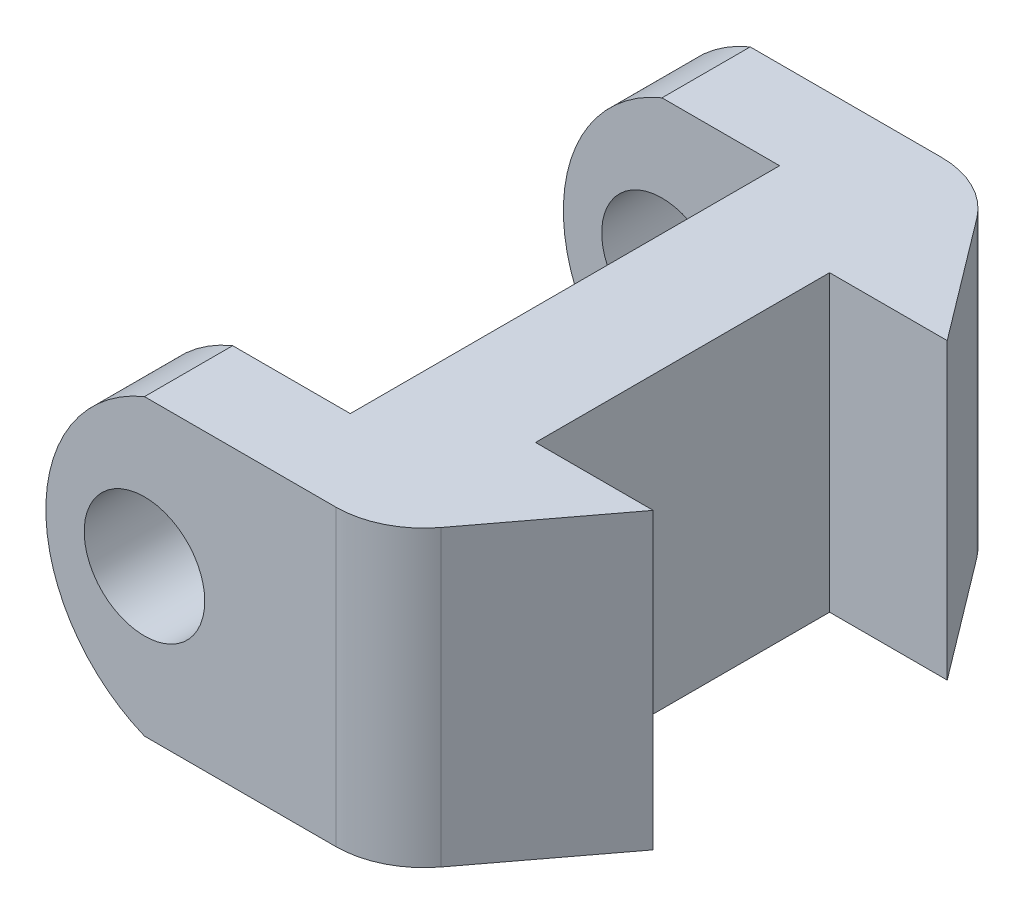
from build123d import *

# Parameters (mm, degrees)
BOSS_EXTRUDE1_DEPTH     = 10
CUT_EXTRUDE1_DEPTH      = 22.113029153
CUT_EXTRUDE1_DEPTH_BACK = 22.113029153
BOSS_EXTRUDE2_DEPTH     = 10
FILLET1_R               = 3
CUT_EXTRUDE2_DEPTH      = 25.987196722
CUT_EXTRUDE2_DEPTH_BACK = 25.987196722


with BuildPart() as part:
    # Sketch1 → Boss-Extrude1 (new body)
    with BuildSketch(Plane(origin=(0, 0, 0), x_dir=(1, 0, 0), z_dir=(0, 1, 0))):
        Polygon((-6, -10.3), (6, -10.3), (6, 10.3), (-6, 10.3), (-6, 7.3), (2, 7.3), (2, -7.3), (-6, -7.3), align=None)
    extrude(amount=BOSS_EXTRUDE1_DEPTH)

    # Sketch2 → Cut-Extrude1 (cut, two sides: drawn at the far end of the back side and taken through both)
    with BuildSketch(Plane.XY.offset(-7.3).offset(-CUT_EXTRUDE1_DEPTH_BACK)):
        with BuildLine():
            ThreePointArc((-3.280624847, 6.600781059), (-3.600781059, 3.719375153), (-0.719375153, 3.399218941))
            Line((-0.719375153, 3.399218941), (-3.280624847, 6.600781059))
        make_face()
        with BuildLine():
            Line((-3.280624847, 6.600781059), (-0.719375153, 3.399218941))
            ThreePointArc((-0.719375153, 3.399218941), (-0.152328366, 4.111963102), (0.05, 5))
            ThreePointArc((0.05, 5), (-1.111963102, 6.847671634), (-3.280624847, 6.600781059))
        make_face()
    extrude(amount=CUT_EXTRUDE1_DEPTH + CUT_EXTRUDE1_DEPTH_BACK, mode=Mode.SUBTRACT)

    # Sketch3 → Boss-Extrude2 (add)
    with BuildSketch(Plane(origin=(0, 10, 0), x_dir=(1, 0, 0), z_dir=(0, 1, 0))):
        Polygon((10, 5), (6, 10.3), (6, 5), align=None)
        Polygon((6, -10.3), (10, -5), (6, -5), align=None)
    extrude(amount=-BOSS_EXTRUDE2_DEPTH)

    # Fillet1
    fillet1_edges = [part.edges().sort_by_distance(p)[0] for p in [
        (6, 5, -10.3),
        (6, 5, 10.3),
    ]]
    fillet(fillet1_edges, radius=FILLET1_R)

    # Sketch4 → Cut-Extrude2 (cut, two sides: drawn at the far end of the back side and taken through both)
    with BuildSketch(Plane(origin=(0, 0, -10.3), x_dir=(-1, 0, 0), z_dir=(0, 0, -1)).offset(-CUT_EXTRUDE2_DEPTH_BACK)):
        with BuildLine():
            Line((2, 10), (6, 10))
            Line((6, 10), (6, 0))
            Line((6, 0), (2, 0))
            ThreePointArc((2, 0), (5.353933752, 5), (2, 10))
        make_face()
    extrude(amount=CUT_EXTRUDE2_DEPTH + CUT_EXTRUDE2_DEPTH_BACK, mode=Mode.SUBTRACT)


solid = part.part
